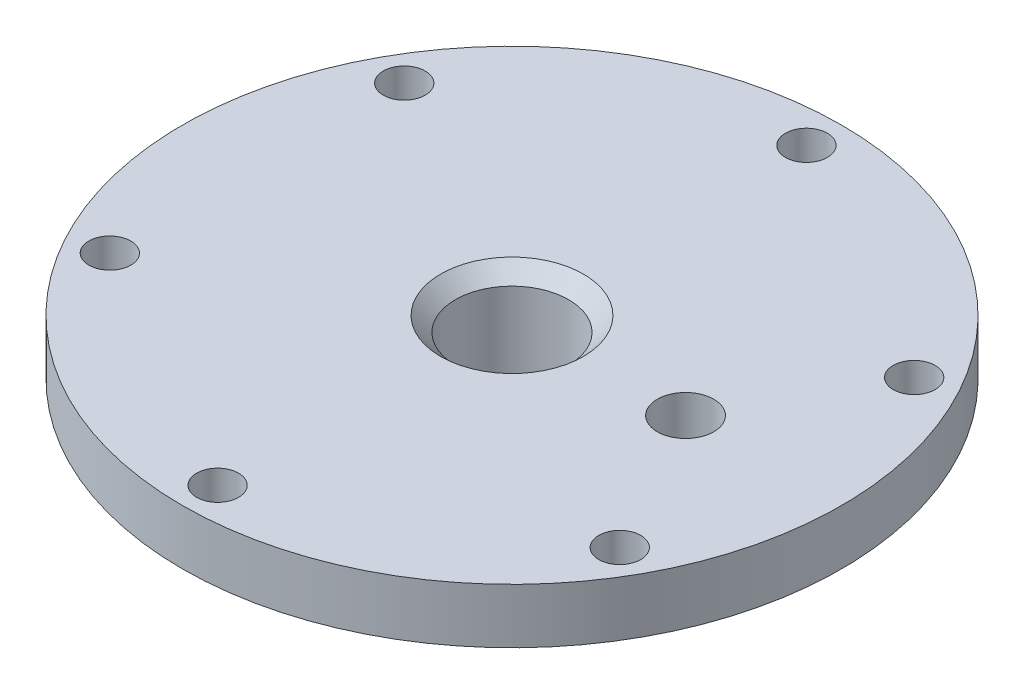
from build123d import *

# Parameters (mm, degrees)
SKETCH1_R                          = 38.1
BOSS_EXTRUDE1_DEPTH                = 6.35
SKETCH2_R                          = 25.273
BOSS_EXTRUDE2_DEPTH                = 6.35
F_11_0_191_DIAMETER_HOLE1_D        = 4.8514
CIRPATTERN1_COUNT                  = 6
F_9_16_18_TAPPED_HOLE1_D           = 13.09624
F_9_16_18_TAPPED_HOLE1_CSINK_D     = 16.51
F_9_16_18_TAPPED_HOLE1_CSINK_ANGLE = 90
F_0_257_DIAMETER_HOLE1_D           = 6.5278


with BuildPart() as part:
    # Sketch1 → Boss-Extrude1 (new body)
    with BuildSketch(Plane(origin=(0, 0, 0), x_dir=(1, 0, 0), z_dir=(0, 1, 0))):
        with Locations(Location((0, 0, 0), (0, 0, 270))):
            Circle(SKETCH1_R)
    extrude(amount=BOSS_EXTRUDE1_DEPTH)

    # Sketch2 → Boss-Extrude2 (add)
    with BuildSketch(Plane(origin=(0, 0, 0), x_dir=(-1, 0, 0), z_dir=(0, -1, 0))):
        with Locations(Location((0, 0, 0), (0, 0, 270))):
            Circle(SKETCH2_R)
    extrude(amount=BOSS_EXTRUDE2_DEPTH)

    # #11 (0.191) Diameter Hole1 (through all)
    with Locations(Plane(origin=(0, 6.35, 0), x_dir=(1, 0, 0), z_dir=(0, 1, 0))):
        with Locations((0, 34.036)):
            f_11_0_191_diameter_hole1 = Hole(F_11_0_191_DIAMETER_HOLE1_D / 2)

    # CirPattern1: #11 (0.191) Diameter Hole1 ×6 about axis
    cirpattern1_axis = Axis((0, 0, 0), (0, 1, 0))
    for i in range(1, CIRPATTERN1_COUNT):
        add(f_11_0_191_diameter_hole1.rotate(cirpattern1_axis, i * 360 / CIRPATTERN1_COUNT), mode=Mode.SUBTRACT)

    # 9/16-18 Tapped Hole1 (through all)
    with Locations(Plane(origin=(0, 6.35, 0), x_dir=(1, 0, 0), z_dir=(0, 1, 0))):
        with Locations((0, 0)):
            CounterSinkHole(F_9_16_18_TAPPED_HOLE1_D / 2, F_9_16_18_TAPPED_HOLE1_CSINK_D / 2, counter_sink_angle=F_9_16_18_TAPPED_HOLE1_CSINK_ANGLE)

    # F (0.257) Diameter Hole1 (through all)
    with Locations(Plane(origin=(0, 6.35, 0), x_dir=(1, 0, 0), z_dir=(0, 1, 0))):
        with Locations((20.066, 0)):
            Hole(F_0_257_DIAMETER_HOLE1_D / 2)


solid = part.part
